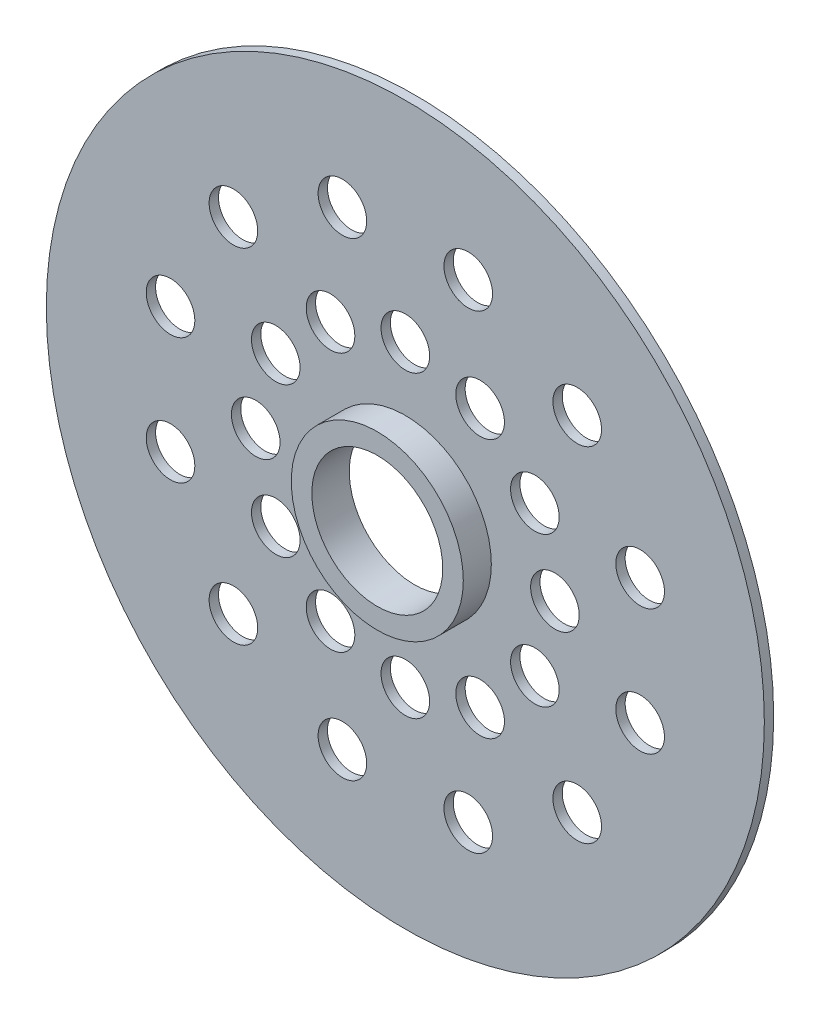
from build123d import *

# Parameters (mm, degrees)
REAR_COVER_REFERENCE_START   = -47
SKETCH_1_R                   = 96
SKETCH_1_R_2                 = 17.5
REAR_COVER_REFERENCE_DEPTH   = 2.5
BEARING_BOSS_REFERENCE_START = -47
SKETCH_2_R                   = 23
SKETCH_2_R_2                 = 17.5
BEARING_BOSS_REFERENCE_DEPTH = 10
SKETCH_3_R                   = 6.5
THROUGH_HOLES_DEPTH          = 100


with BuildPart() as part:
    # Эскиз1 → Rear_cover_reference (new body)
    with BuildSketch(Plane.XY.offset(REAR_COVER_REFERENCE_START)):
        Circle(SKETCH_1_R)
        Circle(SKETCH_1_R_2, mode=Mode.SUBTRACT)
    extrude(amount=REAR_COVER_REFERENCE_DEPTH)

    # Эскиз2 → Bearing_boss_reference (add)
    with BuildSketch(Plane.XY.offset(BEARING_BOSS_REFERENCE_START)):
        Circle(SKETCH_2_R)
        Circle(SKETCH_2_R_2, mode=Mode.SUBTRACT)
    extrude(amount=BEARING_BOSS_REFERENCE_DEPTH)

    # Эскиз3 → Through_holes (cut, symmetric)
    with BuildSketch(Plane.XY):
        with Locations((40, 0)):
            Circle(SKETCH_3_R)
        with Locations((34.641016151, 20)):
            Circle(SKETCH_3_R)
        with Locations((20, 34.641016151)):
            Circle(SKETCH_3_R)
        with Locations((0, 40)):
            Circle(SKETCH_3_R)
        with Locations((-20, 34.641016151)):
            Circle(SKETCH_3_R)
        with Locations((-34.641016151, 20)):
            Circle(SKETCH_3_R)
        with Locations((-40, 0)):
            Circle(SKETCH_3_R)
        with Locations((-34.641016151, -20)):
            Circle(SKETCH_3_R)
        with Locations((-20, -34.641016151)):
            Circle(SKETCH_3_R)
        with Locations((0, -40)):
            Circle(SKETCH_3_R)
        with Locations((20, -34.641016151)):
            Circle(SKETCH_3_R)
        with Locations((34.641016151, -20)):
            Circle(SKETCH_3_R)
        with Locations((62.785178709, 16.823237932)):
            Circle(SKETCH_3_R)
        with Locations((45.961940777, 45.961940777)):
            Circle(SKETCH_3_R)
        with Locations((16.823237932, 62.785178709)):
            Circle(SKETCH_3_R)
        with Locations((-16.823237932, 62.785178709)):
            Circle(SKETCH_3_R)
        with Locations((-45.961940777, 45.961940777)):
            Circle(SKETCH_3_R)
        with Locations((-62.785178709, 16.823237932)):
            Circle(SKETCH_3_R)
        with Locations((-62.785178709, -16.823237932)):
            Circle(SKETCH_3_R)
        with Locations((-45.961940777, -45.961940777)):
            Circle(SKETCH_3_R)
        with Locations((-16.823237932, -62.785178709)):
            Circle(SKETCH_3_R)
        with Locations((16.823237932, -62.785178709)):
            Circle(SKETCH_3_R)
        with Locations((45.961940777, -45.961940777)):
            Circle(SKETCH_3_R)
        with Locations((62.785178709, -16.823237932)):
            Circle(SKETCH_3_R)
    extrude(amount=THROUGH_HOLES_DEPTH, both=True, mode=Mode.SUBTRACT)


solid = part.part
